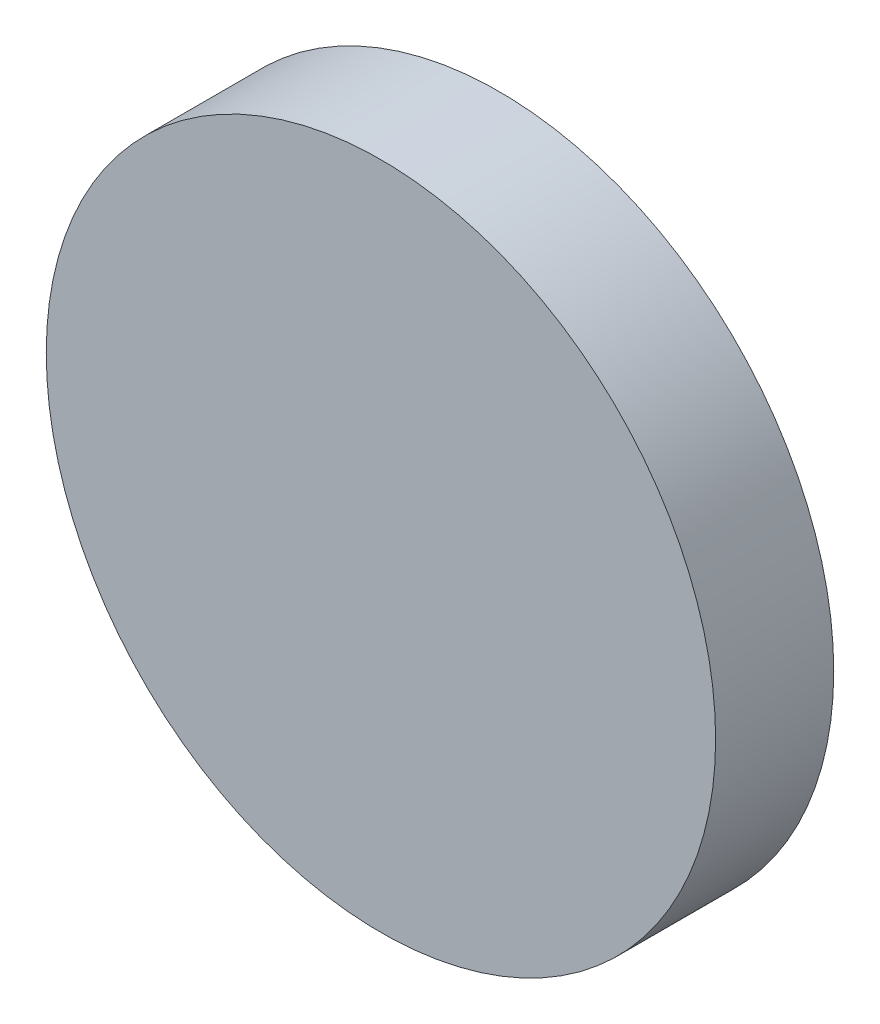
from build123d import *

# Parameters (mm, degrees)
SKETCH1_R           = 34
SKETCH1_R_2         = 32
BOSS_EXTRUDE1_DEPTH = 12
BOSS_EXTRUDE2_START = -2
SKETCH2_R           = 34
BOSS_EXTRUDE2_DEPTH = 2
SKETCH3_R           = 10
SKETCH3_R_2         = 8.5
BOSS_EXTRUDE3_DEPTH = 7


with BuildPart() as part:
    # Sketch1 → Boss-Extrude1 (new body)
    with BuildSketch(Plane.XY):
        Circle(SKETCH1_R)
        Circle(SKETCH1_R_2, mode=Mode.SUBTRACT)
    extrude(amount=BOSS_EXTRUDE1_DEPTH)

    # Sketch2 → Boss-Extrude2 (add)
    with BuildSketch(Plane.XY.offset(12).offset(BOSS_EXTRUDE2_START)):
        Circle(SKETCH2_R)
    extrude(amount=BOSS_EXTRUDE2_DEPTH)

    # Sketch3 → Boss-Extrude3 (add)
    with BuildSketch(Plane(origin=(0, 0, 10), x_dir=(-1, 0, 0), z_dir=(0, 0, -1))):
        with Locations(Location((0, 0, 0), (0, 0, 180))):
            Circle(SKETCH3_R)
        Circle(SKETCH3_R_2, mode=Mode.SUBTRACT)
    extrude(amount=BOSS_EXTRUDE3_DEPTH)


solid = part.part
